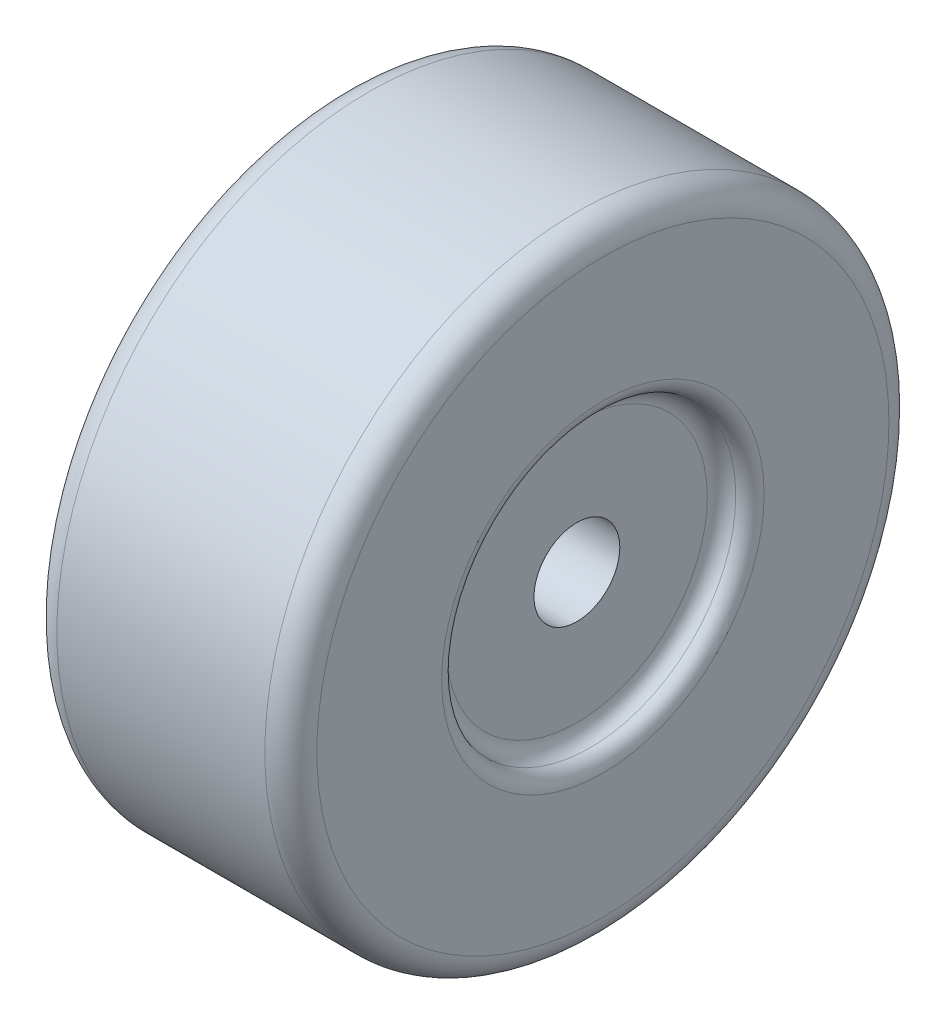
from build123d import *

# Parameters (mm, degrees)
SKETCH_1_R          = 60
EXTRUDE_1_DEPTH     = 25
FILLET_1_R          = 5
SKETCH_2_R          = 8.25
CUT_EXTRUDE_1_DEPTH = 99.488578018
CHAMFER_1_SIZE      = 3
SKETCH_3_R          = 28
CUT_EXTRUDE_2_DEPTH = 5
FILLET_2_R          = 3
FILLET_3_R          = 3
SKETCH_4_R          = 28
CUT_EXTRUDE_3_DEPTH = 5
FILLET_4_R          = 3
FILLET_5_R          = 3


with BuildPart() as part:
    # 草图1 → 凸台-拉伸1 (new, symmetric)
    with BuildSketch(Plane(origin=(0, 0, 0), x_dir=(0, 0, -1), z_dir=(1, 0, 0))):
        Circle(SKETCH_1_R)
    extrude(amount=EXTRUDE_1_DEPTH, both=True)

    # 圆角1
    fillet_1_edges = [part.edges().sort_by_distance(p)[0] for p in [
        (-25, 0, 60),
        (25, 0, 60),
    ]]
    fillet(fillet_1_edges, radius=FILLET_1_R)

    # 草图2 → 切除-拉伸1 (cut, through all)
    with BuildSketch(Plane(origin=(25, 0, 0), x_dir=(0, 0, -1), z_dir=(1, 0, 0))):
        Circle(SKETCH_2_R)
    extrude(amount=-CUT_EXTRUDE_1_DEPTH, mode=Mode.SUBTRACT)

    # 倒角1
    chamfer_1_edges = [part.edges().sort_by_distance(p)[0] for p in [
        (-25, 0, 8.25),
        (25, 0, 8.25),
    ]]
    chamfer(chamfer_1_edges, length=CHAMFER_1_SIZE)

    # 草图3 → 切除-拉伸2 (cut)
    with BuildSketch(Plane(origin=(25, 0, 0), x_dir=(0, 0, -1), z_dir=(1, 0, 0))):
        Circle(SKETCH_3_R)
    extrude(amount=-CUT_EXTRUDE_2_DEPTH, mode=Mode.SUBTRACT)

    # 圆角2
    fillet_2_edges = [part.edges().sort_by_distance(p)[0] for p in [
        (25, 0, 28),
    ]]
    fillet(fillet_2_edges, radius=FILLET_2_R)

    # 圆角3
    fillet_3_edges = [part.edges().sort_by_distance(p)[0] for p in [
        (20, 0, 28),
    ]]
    fillet(fillet_3_edges, radius=FILLET_3_R)

    # 草图4 → 切除-拉伸3 (cut)
    with BuildSketch(Plane.ZY.offset(25)):
        Circle(SKETCH_4_R)
    extrude(amount=-CUT_EXTRUDE_3_DEPTH, mode=Mode.SUBTRACT)

    # 圆角4
    fillet_4_edges = [part.edges().sort_by_distance(p)[0] for p in [
        (-25, 0, -28),
    ]]
    fillet(fillet_4_edges, radius=FILLET_4_R)

    # 圆角5
    fillet_5_edges = [part.edges().sort_by_distance(p)[0] for p in [
        (-20, 0, -28),
    ]]
    fillet(fillet_5_edges, radius=FILLET_5_R)


solid = part.part
